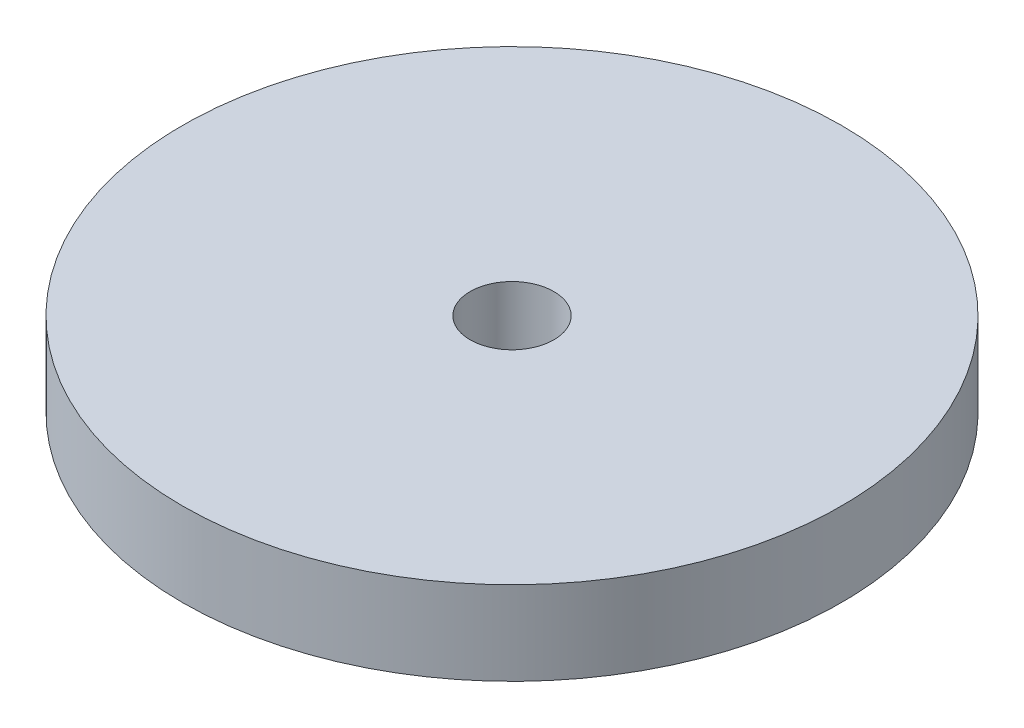
from build123d import *

# Parameters (mm, degrees)
ESQUISSE1_R             = 25
BOSS_EXTRU_1_DEPTH      = 6.35
ENL_V_MAT_EXTRU_1_REACH = 37.921
ESQUISSE2_R             = 3.175


with BuildPart() as part:
    # Esquisse1 → Boss.-Extru.1 (new body)
    with BuildSketch(Plane(origin=(0, 0, 0), x_dir=(1, 0, 0), z_dir=(0, 1, 0))):
        with Locations(Location((0, 0, 0), (0, 0, 270))):
            Circle(ESQUISSE1_R)
    extrude(amount=BOSS_EXTRU_1_DEPTH)

    # Esquisse2 → Enlèv. mat.-Extru.1 (cut, up to next)
    with BuildSketch(Plane(origin=(0, 6.35, 0), x_dir=(1, 0, 0), z_dir=(0, 1, 0)), mode=Mode.PRIVATE) as enl_v_mat_extru_1_sk1:
        with Locations(Location((0, 0, 0), (0, 0, 270))):
            Circle(ESQUISSE2_R)
    enl_v_mat_extru_1_tool1 = extrude(enl_v_mat_extru_1_sk1.sketch, amount=-ENL_V_MAT_EXTRU_1_REACH, mode=Mode.PRIVATE) & part.part
    add(enl_v_mat_extru_1_tool1.solids().sort_by_distance((0, 6.35, 0))[0], mode=Mode.SUBTRACT)


solid = part.part
